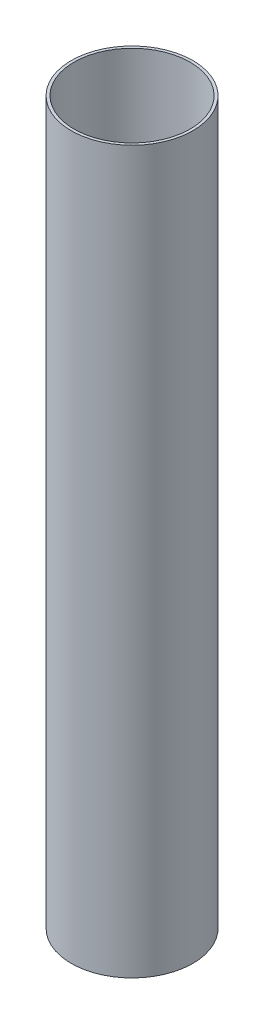
from build123d import *

# Parameters (mm, degrees)
SKETCH1_R           = 109.55
SKETCH1_R_2         = 104.55
EXTRUDE_THIN1_DEPTH = 1299


with BuildPart() as part:
    # Sketch1 → Extrude-Thin1 (new body)
    with BuildSketch(Plane(origin=(0, 0, 0), x_dir=(1, 0, 0), z_dir=(0, 1, 0))):
        Circle(SKETCH1_R)
        Circle(SKETCH1_R_2, mode=Mode.SUBTRACT)
    extrude(amount=EXTRUDE_THIN1_DEPTH)


solid = part.part
